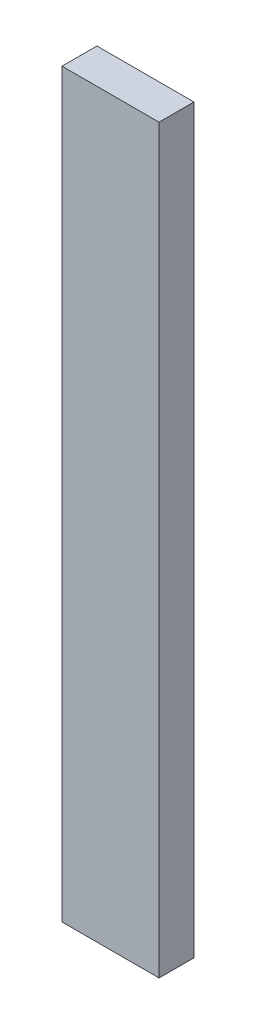
from build123d import *

# Parameters (mm, degrees)
SKETCH1_W           = 50
SKETCH1_H           = 382
BOSS_EXTRUDE1_DEPTH = 18


with BuildPart() as part:
    # Sketch1 → Boss-Extrude1 (new body)
    with BuildSketch(Plane.XY):
        Rectangle(SKETCH1_W, SKETCH1_H)
    extrude(amount=BOSS_EXTRUDE1_DEPTH)


solid = part.part
